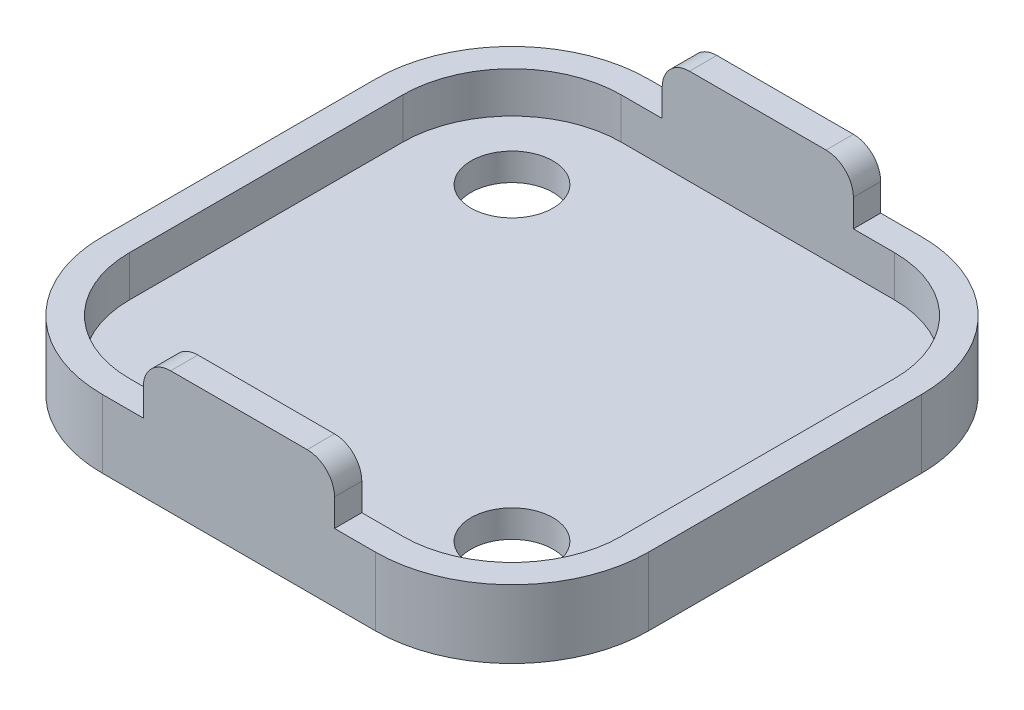
from build123d import *

# Parameters (mm, degrees)
SKETCH1_W           = 20
SKETCH1_H           = 20
BOSS_EXTRUDE1_DEPTH = 2.5
FILLET1_R           = 5
SKETCH2_R           = 1.5
CUT_EXTRUDE1_DEPTH  = 10
CUT_EXTRUDE2_DEPTH  = 1.5
SKETCH4_W           = 7
SKETCH4_H           = 1
BOSS_EXTRUDE2_DEPTH = 2
FILLET2_R           = 1


with BuildPart() as part:
    # Sketch1 → Boss-Extrude1 (new body)
    with BuildSketch(Plane(origin=(0, 0, 0), x_dir=(1, 0, 0), z_dir=(0, 1, 0))):
        Rectangle(SKETCH1_W, SKETCH1_H)
    extrude(amount=BOSS_EXTRUDE1_DEPTH)

    # Fillet1
    fillet1_edges = [part.edges().sort_by_distance(p)[0] for p in [
        (10, 1.25, 10),
        (-10, 1.25, 10),
        (-10, 1.25, -10),
        (10, 1.25, -10),
    ]]
    fillet(fillet1_edges, radius=FILLET1_R)

    # Sketch2 → Cut-Extrude1 (cut)
    with BuildSketch(Plane(origin=(0, 2.5, 0), x_dir=(1, 0, 0), z_dir=(0, 1, 0))):
        with Locations(Location((5.656854249, -5.656854249, 0), (0, 0, 270))):
            Circle(SKETCH2_R)
        with Locations(Location((-5.656854249, 5.656854249, 0), (0, 0, 270))):
            Circle(SKETCH2_R)
    extrude(amount=-CUT_EXTRUDE1_DEPTH, mode=Mode.SUBTRACT)

    # Sketch3 → Cut-Extrude2 (cut)
    with BuildSketch(Plane(origin=(0, 2.5, 0), x_dir=(1, 0, 0), z_dir=(0, 1, 0))):
        with BuildLine():
            Line((5, 9), (-5, 9))
            ThreePointArc((-5, 9), (-7.828427125, 7.828427125), (-9, 5))
            Line((-9, 5), (-9, -5))
            ThreePointArc((-9, -5), (-7.828427125, -7.828427125), (-5, -9))
            Line((-5, -9), (5, -9))
            ThreePointArc((5, -9), (7.828427125, -7.828427125), (9, -5))
            Line((9, -5), (9, 5))
            ThreePointArc((9, 5), (7.828427125, 7.828427125), (5, 9))
        make_face()
    extrude(amount=-CUT_EXTRUDE2_DEPTH, mode=Mode.SUBTRACT)

    # Sketch4 → Boss-Extrude2 (add)
    with BuildSketch(Plane(origin=(0, 2.5, 0), x_dir=(1, 0, 0), z_dir=(0, 1, 0))):
        with Locations((0, 9.5)):
            Rectangle(SKETCH4_W, SKETCH4_H)
        with Locations((0, -9.5)):
            Rectangle(SKETCH4_W, SKETCH4_H)
    extrude(amount=BOSS_EXTRUDE2_DEPTH)

    # Fillet2
    fillet2_edges = [part.edges().sort_by_distance(p)[0] for p in [
        (-3.5, 4.5, -9.5),
        (3.5, 4.5, -9.5),
        (-3.5, 4.5, 9.5),
        (3.5, 4.5, 9.5),
    ]]
    fillet(fillet2_edges, radius=FILLET2_R)


solid = part.part
